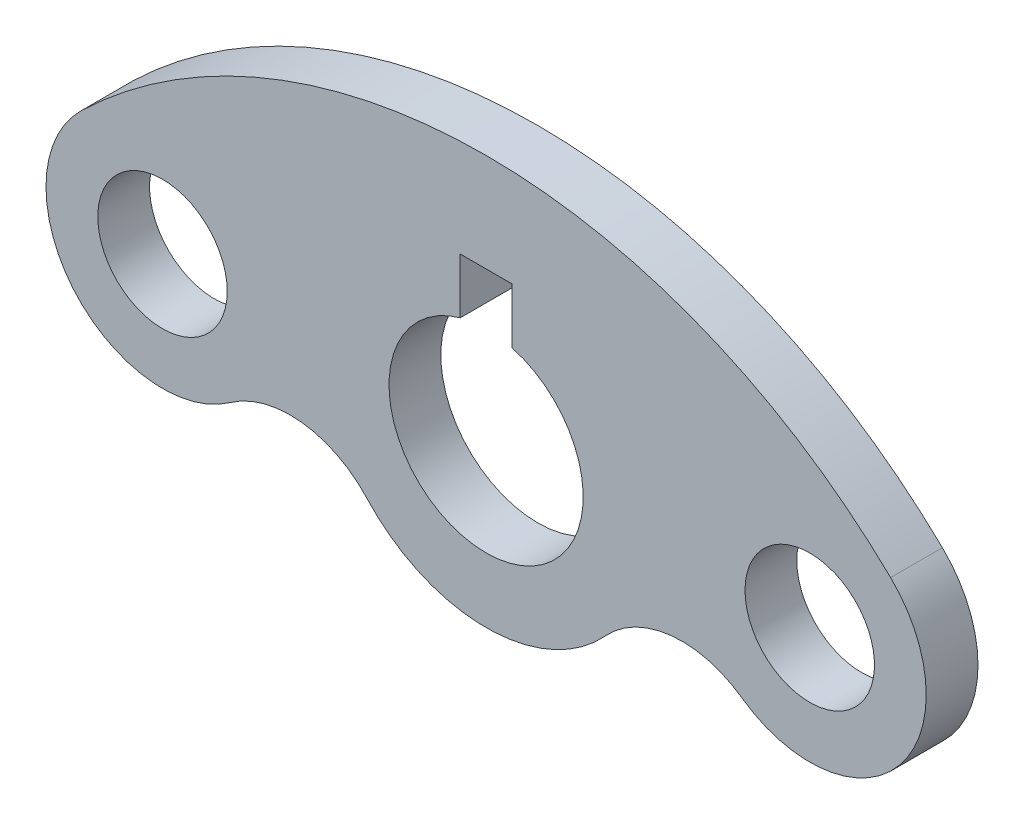
from build123d import *

# Parameters (mm, degrees)
CROQUIS1_R              = 10
SALIENTE_EXTRUIR2_DEPTH = 8


with BuildPart() as part:
    # Croquis1 → Saliente-Extruir2 (new body)
    with BuildSketch(Plane.XY):
        with BuildLine():
            ThreePointArc((-62.5, 12.951833847), (0, 38.192664612), (62.5, 12.951833847))
            ThreePointArc((62.5, 12.951833847), (63.839595947, -11.509369402), (39.544117647, -14.651775463))
            ThreePointArc((39.544117647, -14.651775463), (28.573082694, -11.763695145), (18.445121951, -16.875351143))
            ThreePointArc((18.445121951, -16.875351143), (0, -25), (-18.445121951, -16.875351143))
            ThreePointArc((-18.445121951, -16.875351143), (-28.573082694, -11.763695145), (-39.544117647, -14.651775463))
            ThreePointArc((-39.544117647, -14.651775463), (-63.839595947, -11.509369402), (-62.5, 12.951833847))
        make_face()
        with Locations((-50, 0)):
            Circle(CROQUIS1_R, mode=Mode.SUBTRACT)
        with Locations(Location((50, 0, 0), (0, 0, 180))):
            Circle(CROQUIS1_R, mode=Mode.SUBTRACT)
        with BuildLine():
            Line((4, 14.456832295), (4, 23))
            Line((4, 23), (-4, 23))
            Line((-4, 23), (-4, 14.456832295))
            ThreePointArc((-4, 14.456832295), (0, -15), (4, 14.456832295))
        make_face(mode=Mode.SUBTRACT)
    extrude(amount=SALIENTE_EXTRUIR2_DEPTH)


solid = part.part
